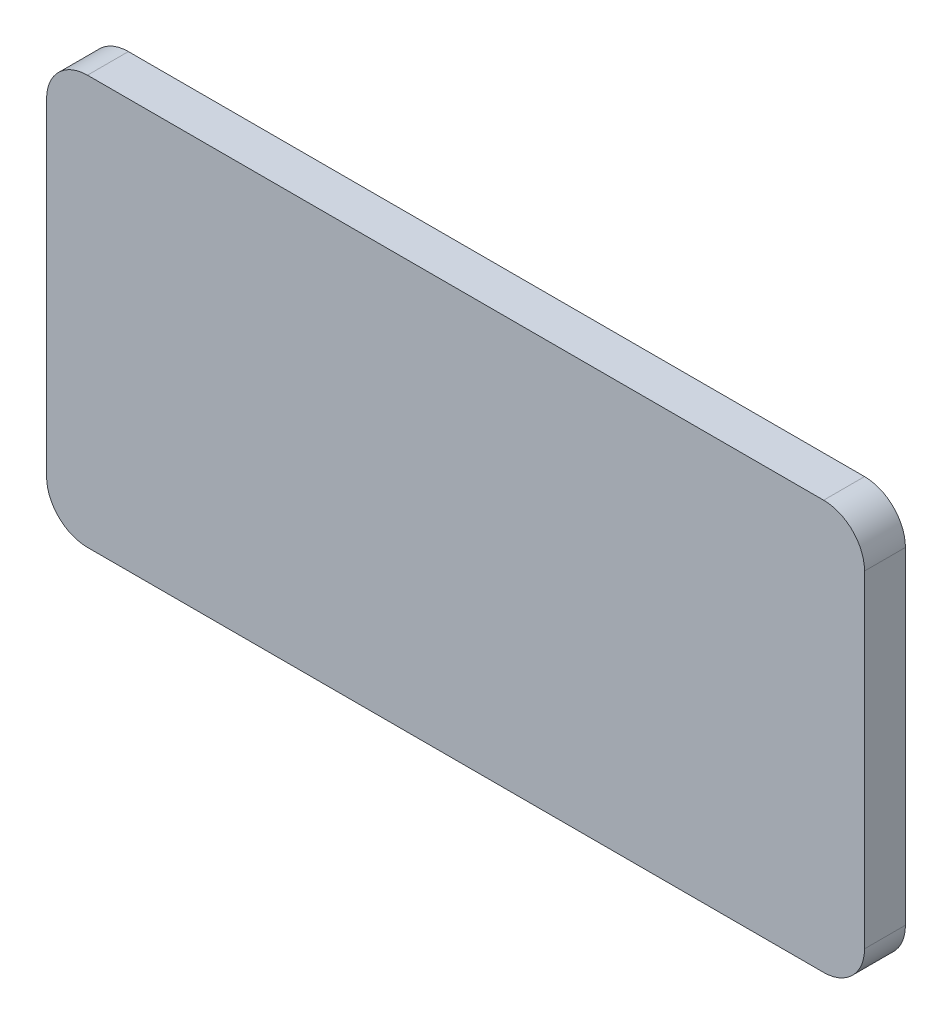
from build123d import *

# Parameters (mm, degrees)
ESQUISSE1_W        = 100
ESQUISSE1_H        = 50
BOSS_EXTRU_1_DEPTH = 5
CONG_2_R           = 5


with BuildPart() as part:
    # Esquisse1 → Boss.-Extru.1 (new body)
    with BuildSketch(Plane.XY):
        with Locations((-50, -25)):
            Rectangle(ESQUISSE1_W, ESQUISSE1_H)
    extrude(amount=BOSS_EXTRU_1_DEPTH)

    # Congé2
    cong_2_edges = [part.edges().sort_by_distance(p)[0] for p in [
        (0, -50, 2.5),
        (-100, -50, 2.5),
        (-100, 0, 2.5),
        (0, 0, 2.5),
    ]]
    fillet(cong_2_edges, radius=CONG_2_R)


solid = part.part
